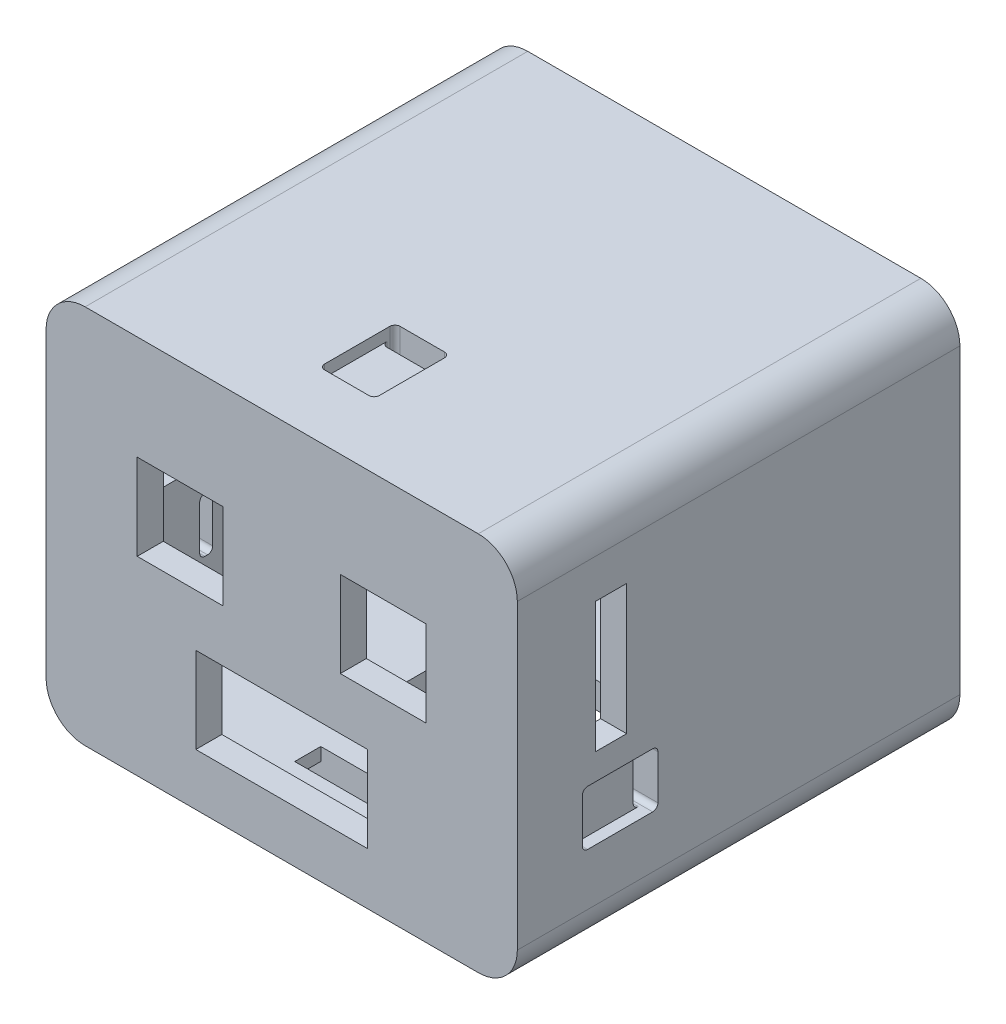
from build123d import *

# Parameters (mm, degrees)
SKETCH1_W           = 66
SKETCH1_H           = 33
SKETCH1_W_2         = 33
BOSS_EXTRUDE1_DEPTH = 170
SKETCH3_W           = 161
SKETCH3_H           = 126
CUT_EXTRUDE1_DEPTH  = 160
CUT_EXTRUDE2_DEPTH  = 4.5
CUT_EXTRUDE3_DEPTH  = 18.5
SKETCH6_W           = 235.512636351
SKETCH6_H           = 50
CUT_EXTRUDE4_DEPTH  = 12
CUT_EXTRUDE5_DEPTH  = 4.5
CUT_EXTRUDE6_DEPTH  = 10
SKETCH9_W           = 60
SKETCH9_H           = 10
CUT_EXTRUDE7_DEPTH  = 5
SKETCH10_W          = 40
SKETCH10_H          = 10
CUT_EXTRUDE8_DEPTH  = 5
SKETCH11_W          = 50
SKETCH11_H          = 50
CUT_EXTRUDE11_DEPTH = 3
CUT_EXTRUDE12_DEPTH = 10


with BuildPart() as part:
    # Sketch1 → Boss-Extrude1 (new body)
    with BuildSketch(Plane.XY):
        with BuildLine():
            Line((15, 0), (166, 0))
            ThreePointArc((166, 0), (176.606601718, 4.393398282), (181, 15))
            Line((181, 15), (181, 131))
            ThreePointArc((181, 131), (176.606601718, 141.606601718), (166, 146))
            Line((166, 146), (15, 146))
            ThreePointArc((15, 146), (4.393398282, 141.606601718), (0, 131))
            Line((0, 131), (0, 15))
            ThreePointArc((0, 15), (4.393398282, 4.393398282), (15, 0))
        make_face()
        with Locations((90.5, 36.5)):
            Rectangle(SKETCH1_W, SKETCH1_H, mode=Mode.SUBTRACT)
        with Locations((51.5, 89.5)):
            Rectangle(SKETCH1_W_2, SKETCH1_H, mode=Mode.SUBTRACT)
        with Locations((129.5, 89.5)):
            Rectangle(SKETCH1_W_2, SKETCH1_H, mode=Mode.SUBTRACT)
    extrude(amount=-BOSS_EXTRUDE1_DEPTH)

    # Sketch3 → Cut-Extrude1 (cut)
    with BuildSketch(Plane(origin=(0, 0, -170), x_dir=(-1, 0, 0), z_dir=(0, 0, -1))):
        with Locations((-90.5, 73)):
            Rectangle(SKETCH3_W, SKETCH3_H)
    extrude(amount=-CUT_EXTRUDE1_DEPTH, mode=Mode.SUBTRACT)

    # Sketch4 → Cut-Extrude2 (cut)
    with BuildSketch(Plane(origin=(0, 146, 0), x_dir=(1, 0, 0), z_dir=(0, 1, 0))):
        with BuildLine():
            Line((82, 54), (99, 54))
            ThreePointArc((99, 54), (100.414213562, 53.414213562), (101, 52))
            Line((101, 52), (101, 27))
            ThreePointArc((101, 27), (100.414213562, 25.585786438), (99, 25))
            Line((99, 25), (82, 25))
            ThreePointArc((82, 25), (80.585786438, 25.585786438), (80, 27))
            Line((80, 27), (80, 52))
            ThreePointArc((80, 52), (80.585786438, 53.414213562), (82, 54))
        make_face()
    extrude(amount=-CUT_EXTRUDE2_DEPTH, mode=Mode.SUBTRACT)

    # Sketch5 → Cut-Extrude3 (cut)
    with BuildSketch(Plane(origin=(0, 141.5, 0), x_dir=(1, 0, 0), z_dir=(0, 1, 0))):
        with BuildLine():
            Line((82, 49), (99, 49))
            ThreePointArc((99, 49), (100.414213562, 49.585786438), (101, 51))
            Line((101, 51), (101, 52))
            ThreePointArc((101, 52), (100.414213562, 53.414213562), (99, 54))
            Line((99, 54), (82, 54))
            ThreePointArc((82, 54), (80.585786438, 53.414213562), (80, 52))
            Line((80, 52), (80, 51))
            ThreePointArc((80, 51), (80.585786438, 49.585786438), (82, 49))
        make_face()
    extrude(amount=-CUT_EXTRUDE3_DEPTH, mode=Mode.SUBTRACT)

    # Sketch6 → Cut-Extrude4 (cut)
    with BuildSketch(Plane.XY.offset(-30)):
        with Locations((109.011273796, 91)):
            Rectangle(SKETCH6_W, SKETCH6_H)
    extrude(amount=-CUT_EXTRUDE4_DEPTH, mode=Mode.SUBTRACT)

    # Sketch7 → Cut-Extrude5 (cut)
    with BuildSketch(Plane(origin=(181, 0, 0), x_dir=(0, 0, -1), z_dir=(1, 0, 0))):
        with BuildLine():
            Line((27, 56), (52, 56))
            ThreePointArc((52, 56), (53.414213562, 55.414213562), (54, 54))
            Line((54, 54), (54, 37))
            ThreePointArc((54, 37), (53.414213562, 35.585786438), (52, 35))
            Line((52, 35), (27, 35))
            ThreePointArc((27, 35), (25.585786438, 35.585786438), (25, 37))
            Line((25, 37), (25, 54))
            ThreePointArc((25, 54), (25.585786438, 55.414213562), (27, 56))
        make_face()
    cut_extrude5 = extrude(amount=-CUT_EXTRUDE5_DEPTH, mode=Mode.SUBTRACT)

    # Sketch8 → Cut-Extrude6 (cut)
    with BuildSketch(Plane(origin=(176.5, 0, 0), x_dir=(0, 0, -1), z_dir=(1, 0, 0))):
        with BuildLine():
            Line((51, 56), (52, 56))
            ThreePointArc((52, 56), (53.414213562, 55.414213562), (54, 54))
            Line((54, 54), (54, 37))
            ThreePointArc((54, 37), (53.414213562, 35.585786438), (52, 35))
            Line((52, 35), (51, 35))
            ThreePointArc((51, 35), (49.585786438, 35.585786438), (49, 37))
            Line((49, 37), (49, 54))
            ThreePointArc((49, 54), (49.585786438, 55.414213562), (51, 56))
        make_face()
    cut_extrude6 = extrude(amount=-CUT_EXTRUDE6_DEPTH, mode=Mode.SUBTRACT)

    # Mirror1: Cut-Extrude5, Cut-Extrude6 across plane
    add(cut_extrude5.mirror(Plane(origin=(90.5, 0, 0), x_dir=(0, 0, 1), z_dir=(1, 0, 0))), mode=Mode.SUBTRACT)
    add(cut_extrude6.mirror(Plane(origin=(90.5, 0, 0), x_dir=(0, 0, 1), z_dir=(1, 0, 0))), mode=Mode.SUBTRACT)

    # Sketch9 → Cut-Extrude7 (cut)
    with BuildSketch(Plane.XZ):
        with Locations((90.5, -30)):
            Rectangle(SKETCH9_W, SKETCH9_H)
        with Locations((90.5, -145)):
            Rectangle(SKETCH9_W, SKETCH9_H)
    extrude(amount=-CUT_EXTRUDE7_DEPTH, mode=Mode.SUBTRACT)

    # Sketch10 → Cut-Extrude8 (cut)
    with BuildSketch(Plane.XZ.offset(-5)):
        with Locations((90.5, -30)):
            Rectangle(SKETCH10_W, SKETCH10_H)
        with Locations((90.5, -145)):
            Rectangle(SKETCH10_W, SKETCH10_H)
    extrude(amount=-CUT_EXTRUDE8_DEPTH, mode=Mode.SUBTRACT)

    # Sketch11 → Cut-Extrude11 (cut)
    with BuildSketch(Plane(origin=(0, 10, 0), x_dir=(1, 0, 0), z_dir=(0, 1, 0))):
        with Locations((90.5, 85)):
            Rectangle(SKETCH11_W, SKETCH11_H)
    extrude(amount=-CUT_EXTRUDE11_DEPTH, mode=Mode.SUBTRACT)

    # Sketch12 → Cut-Extrude12 (cut)
    with BuildSketch(Plane(origin=(0, 7, 0), x_dir=(1, 0, 0), z_dir=(0, 1, 0))):
        Polygon((75.5, 110), (105.5, 110), (115.5, 99.999999773), (115.5, 69.999999773), (105.5, 60), (75.5, 60), (65.5, 70.000000227), (65.5, 100.000000227), align=None)
    extrude(amount=-CUT_EXTRUDE12_DEPTH, mode=Mode.SUBTRACT)


solid = part.part
